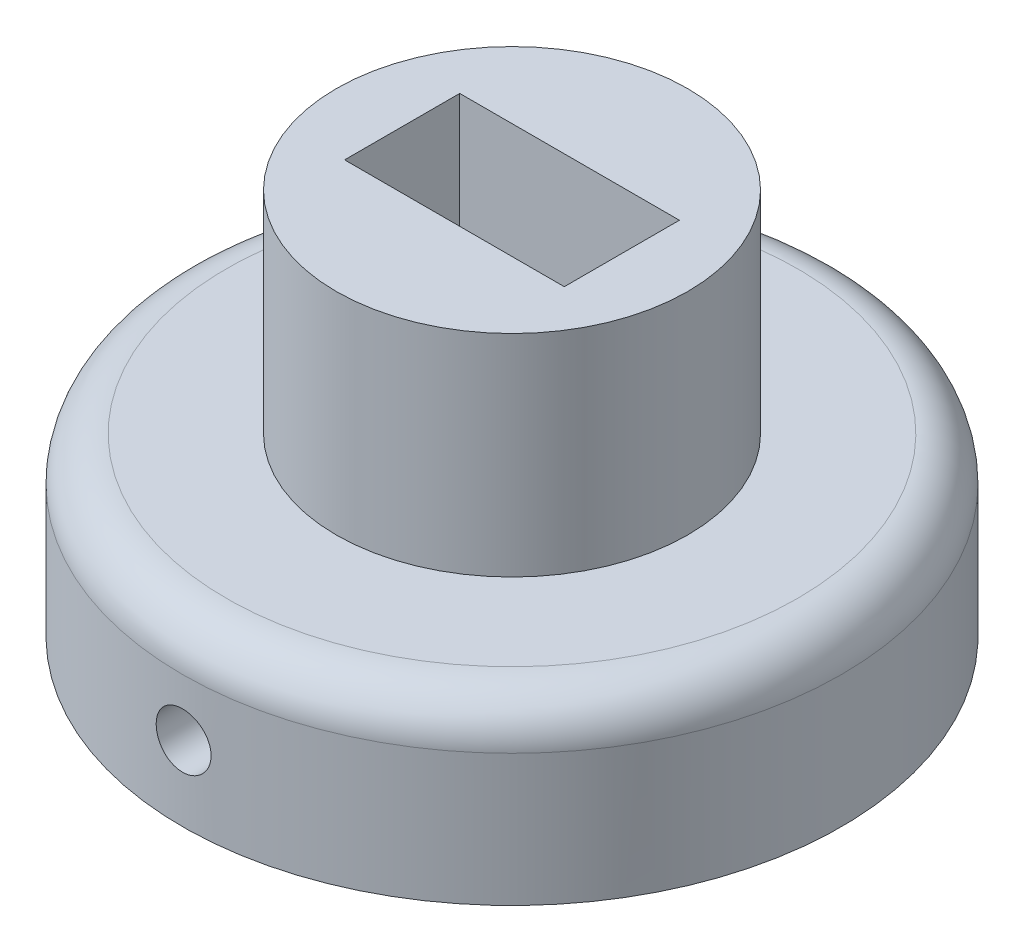
from build123d import *

# Parameters (mm, degrees)
CUT_EXTRUDE1_DEPTH      = 4.318
SKETCH4_W               = 6.35
SKETCH4_H               = 3.3274
CUT_EXTRUDE2_DEPTH      = 7.112
CUT_EXTRUDE3_DEPTH      = 22.07205187
CUT_EXTRUDE3_DEPTH_BACK = 22.07205187
SKETCH5_R               = 0.79375
FILLET2_R               = 1.27


with BuildPart() as part:
    # Sketch2 → Revolve1 (revolve)
    with BuildSketch(Plane.XY, mode=Mode.PRIVATE) as revolve1_sk:
        Polygon((9.525, 0), (9.525, 5.08), (5.08, 5.08), (5.08, 11.176), (0, 11.176), (0, 0), align=None)
    revolve(revolve1_sk.sketch.rotate(Axis((0, 11.176, 0), (0, -1, 0)), 180), axis=Axis((0, 11.176, 0), (0, -1, 0)))

    # Sketch3 → Cut-Extrude1 (cut)
    with BuildSketch(Plane.XZ):
        Polygon((6.452466608, 0), (3.226233304, 5.588), (-3.226233304, 5.588), (-6.452466608, 0), (-3.226233304, -5.588), (3.226233304, -5.588), align=None)
    extrude(amount=-CUT_EXTRUDE1_DEPTH, mode=Mode.SUBTRACT)

    # Sketch4 → Cut-Extrude2 (cut)
    with BuildSketch(Plane(origin=(0, 11.176, 0), x_dir=(1, 0, 0), z_dir=(0, 1, 0))):
        Rectangle(SKETCH4_W, SKETCH4_H)
    extrude(amount=-CUT_EXTRUDE2_DEPTH, mode=Mode.SUBTRACT)

    # Sketch5 → Cut-Extrude3 (cut, two sides: drawn at the far end of the back side and taken through both)
    with BuildSketch(Plane.XY.offset(-5.588).offset(-CUT_EXTRUDE3_DEPTH_BACK)):
        with Locations((0, 2.159)):
            Circle(SKETCH5_R)
    extrude(amount=CUT_EXTRUDE3_DEPTH + CUT_EXTRUDE3_DEPTH_BACK, mode=Mode.SUBTRACT)

    # Fillet2
    fillet2_edges = [part.edges().sort_by_distance(p)[0] for p in [
        (9.525, 5.08, 0),
    ]]
    fillet(fillet2_edges, radius=FILLET2_R)


solid = part.part
